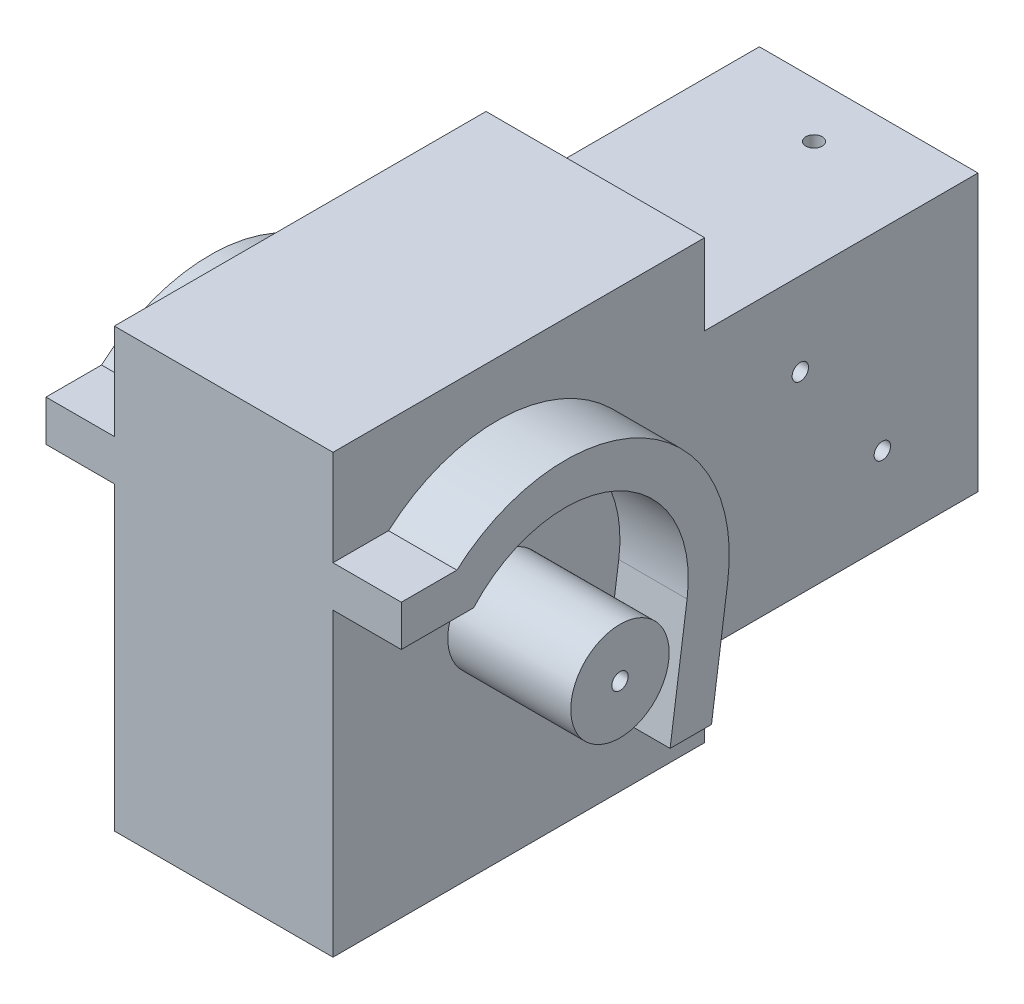
from build123d import *

# Parameters (mm, degrees)
SKETCH_2_W           = 23.6
SKETCH_2_H           = 16
EXTRUDE_1_DEPTH      = 4
EXTRUDE_START        = 4
EXTRUDE_3_DEPTH      = 4.5
SKETCH_5_R           = 0.3
CUT_EXTRUDE_10_DEPTH = 1
EXTRUDE_2_DEPTH      = 2.5
SKETCH_6_W           = 4
SKETCH_6_H           = 2.95
CUT_EXTRUDE_11_DEPTH = 10
SKETCH_7_R           = 0.3
CUT_EXTRUDE_12_DEPTH = 24.50132975
SKETCH_8_W           = 13.6
SKETCH_8_H           = 2.95
CUT_EXTRUDE_13_DEPTH = 2.5
CUT_EXTRUDE_14_REACH = 25.022
SKETCH_9_R           = 0.3


with BuildPart() as part:
    # 草图2 → 凸台-拉伸1 (new body)
    with BuildSketch(Plane(origin=(0, 0, 0), x_dir=(0, 0, -1), z_dir=(1, 0, 0))):
        with Locations((5.8, 0)):
            Rectangle(SKETCH_2_W, SKETCH_2_H)
    extrude(amount=EXTRUDE_1_DEPTH)

    # 草图2<10> → 凸台-拉伸3 (add)
    with BuildSketch(Plane(origin=(0, 0, 0), x_dir=(0, 0, -1), z_dir=(1, 0, 0)).offset(EXTRUDE_START)):
        with BuildLine():
            ThreePointArc((0, -1.8), (1.272792206, -1.272792206), (1.8, 0))
            Line((1.8, 0), (0, 0))
            Line((0, 0), (0, -1.8))
        make_face()
        with BuildLine():
            Line((0, 0), (1.8, 0))
            ThreePointArc((1.8, 0), (1.272792206, 1.272792206), (0, 1.8))
            Line((0, 1.8), (0, 0))
        make_face()
        with BuildLine():
            Line((0, -1.8), (0, 0))
            Line((0, 0), (-1.8, 0))
            ThreePointArc((-1.8, 0), (-1.272792206, -1.272792206), (0, -1.8))
        make_face()
        with BuildLine():
            Line((-1.8, 0), (0, 0))
            Line((0, 0), (0, 1.8))
            ThreePointArc((0, 1.8), (-1.272792206, 1.272792206), (-1.8, 0))
        make_face()
    extrude(amount=EXTRUDE_3_DEPTH)

    # 草图5 → 切除-拉伸10 (cut)
    with BuildSketch(Plane(origin=(8.5, 0, 0), x_dir=(0, 0, -1), z_dir=(1, 0, 0))):
        Circle(SKETCH_5_R)
    extrude(amount=-CUT_EXTRUDE_10_DEPTH, mode=Mode.SUBTRACT)

    # 草图2<4> → 凸台-拉伸2 (add)
    with BuildSketch(Plane(origin=(0, 0, 0), x_dir=(0, 0, -1), z_dir=(1, 0, 0)).offset(EXTRUDE_START)):
        with BuildLine():
            ThreePointArc((-3.354101966, 3), (-1.837117307, 4.107919181), (0, 4.5))
            Line((0, 4.5), (-3.968626967, 4.5))
            ThreePointArc((-3.968626967, 4.5), (-4.643360347, 3.799895352), (-5.196152423, 3))
            Line((-5.196152423, 3), (-3.354101966, 3))
        make_face()
        with BuildLine():
            Line((0, 5), (1.8, 5))
            Line((1.8, 5), (1.8, 5.723635209))
            ThreePointArc((1.8, 5.723635209), (-1.245012655, 5.869407422), (-3.968626967, 4.5))
            Line((-3.968626967, 4.5), (0, 4.5))
            Line((0, 4.5), (0, 5))
        make_face()
        with BuildLine():
            ThreePointArc((0, 4.5), (0.919393397, 4.405078408), (1.8, 4.124318125))
            Line((1.8, 4.124318125), (1.8, 5))
            Line((1.8, 5), (0, 5))
            Line((0, 5), (0, 4.5))
        make_face()
        with BuildLine():
            ThreePointArc((1.8, 4.124318125), (3.764970119, 2.464751509), (4.5, 0))
            Line((4.5, 0), (6, 0))
            ThreePointArc((6, 0), (5.286764074, 2.837274331), (3.31662479, 5))
            Line((3.31662479, 5), (1.8, 5))
            Line((1.8, 5), (1.8, 4.124318125))
        make_face()
        with BuildLine():
            Line((1.8, 5.723635209), (1.8, 5))
            Line((1.8, 5), (3.31662479, 5))
            ThreePointArc((3.31662479, 5), (2.583771331, 5.415175501), (1.8, 5.723635209))
        make_face()
        with BuildLine():
            Line((6, 0), (4.5, 0))
            ThreePointArc((4.5, 0), (4.489038226, -0.313904132), (4.456206309, -0.626278954))
            Line((4.456206309, -0.626278954), (3.903880188, -4.556283516))
            ThreePointArc((3.903880188, -4.556283516), (5.262635021, -2.881782892), (5.941608412, -0.835038606))
            ThreePointArc((5.941608412, -0.835038606), (5.985384302, -0.418538842), (6, 0))
        make_face()
        with BuildLine():
            Line((5.356261262, -5), (5.941608412, -0.835038606))
            ThreePointArc((5.941608412, -0.835038606), (5.262635021, -2.881782892), (3.903880188, -4.556283516))
            Line((3.903880188, -4.556283516), (3.841519903, -5))
            Line((3.841519903, -5), (5.356261262, -5))
        make_face()
        Polygon((4.934638757, -8), (5.356261262, -5), (3.841519903, -5), (3.419897399, -8), align=None)
        with BuildLine():
            ThreePointArc((-5.196152423, 3), (-4.643360347, 3.799895352), (-3.968626967, 4.5))
            Line((-3.968626967, 4.5), (-6, 4.5))
            Line((-6, 4.5), (-6, 3))
            Line((-6, 3), (-5.196152423, 3))
        make_face()
    extrude(amount=EXTRUDE_2_DEPTH)

    # 草图6 → 切除-拉伸11 (cut)
    with BuildSketch(Plane(origin=(0, 0, -17.6), x_dir=(-1, 0, 0), z_dir=(0, 0, -1))):
        with Locations((-2, 6.525)):
            Rectangle(SKETCH_6_W, SKETCH_6_H)
        with Locations((-2, -6.525)):
            Rectangle(SKETCH_6_W, SKETCH_6_H)
    extrude(amount=-CUT_EXTRUDE_11_DEPTH, mode=Mode.SUBTRACT)

    # 草图7 → 切除-拉伸12 (cut, through all)
    with BuildSketch(Plane.XZ.offset(5.05)):
        with Locations((0, -9.6)):
            Circle(SKETCH_7_R)
        with Locations((0, -15.6)):
            Circle(SKETCH_7_R)
    extrude(amount=-CUT_EXTRUDE_12_DEPTH, mode=Mode.SUBTRACT)

    # 草图8 → 切除-拉伸13 (cut)
    with BuildSketch(Plane(origin=(6.5, 0, 0), x_dir=(0, 0, -1), z_dir=(1, 0, 0))):
        with Locations((0.8, -6.525)):
            Rectangle(SKETCH_8_W, SKETCH_8_H)
    extrude(amount=-CUT_EXTRUDE_13_DEPTH, mode=Mode.SUBTRACT)

    # 镜向1: part across plane


with BuildPart() as part_1:
    add(part.part)
    add(part.part.mirror(Plane(origin=(0, 0, 0), x_dir=(0, 0, 1), z_dir=(1, 0, 0))))

    # 草图9 → 切除-拉伸14 (cut, up to next)
    with BuildSketch(Plane.ZY.offset(4), mode=Mode.PRIVATE) as cut_extrude_14_sk1:
        with Locations((-14.1, -2)):
            Circle(SKETCH_9_R)
    cut_extrude_14_tool1 = extrude(cut_extrude_14_sk1.sketch, amount=-CUT_EXTRUDE_14_REACH, mode=Mode.PRIVATE) & part_1.part
    # 草图9 → 切除-拉伸14 (cut, up to next)
    with BuildSketch(Plane.ZY.offset(4), mode=Mode.PRIVATE) as cut_extrude_14_sk2:
        with Locations((-11.1, 2)):
            Circle(SKETCH_9_R)
    cut_extrude_14_tool2 = extrude(cut_extrude_14_sk2.sketch, amount=-CUT_EXTRUDE_14_REACH, mode=Mode.PRIVATE) & part_1.part
    add(cut_extrude_14_tool1.solids().sort_by_distance((-4, -2, -14.1))[0], mode=Mode.SUBTRACT)
    add(cut_extrude_14_tool2.solids().sort_by_distance((-4, 2, -11.1))[0], mode=Mode.SUBTRACT)


solid = part_1.part
